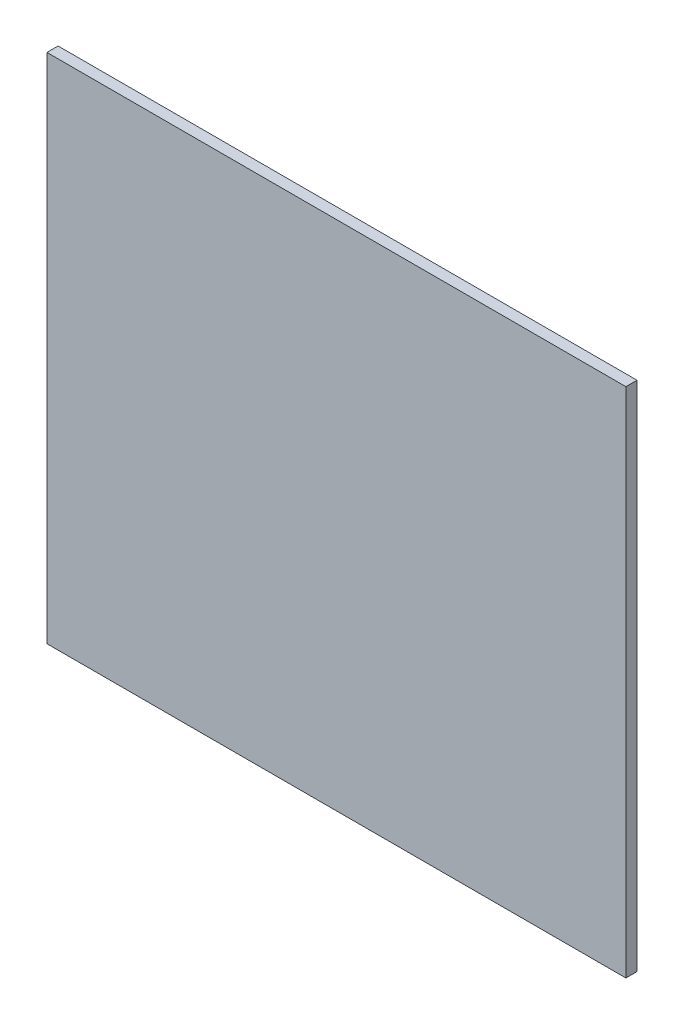
from build123d import *

# Parameters (mm, degrees)
CROQUIS1_W              = 260
CROQUIS1_H              = 230
SALIENTE_EXTRUIR1_DEPTH = 5


with BuildPart() as part:
    # Croquis1 → Saliente-Extruir1 (new body)
    with BuildSketch(Plane.XY):
        Rectangle(CROQUIS1_W, CROQUIS1_H)
    extrude(amount=SALIENTE_EXTRUIR1_DEPTH)


solid = part.part
